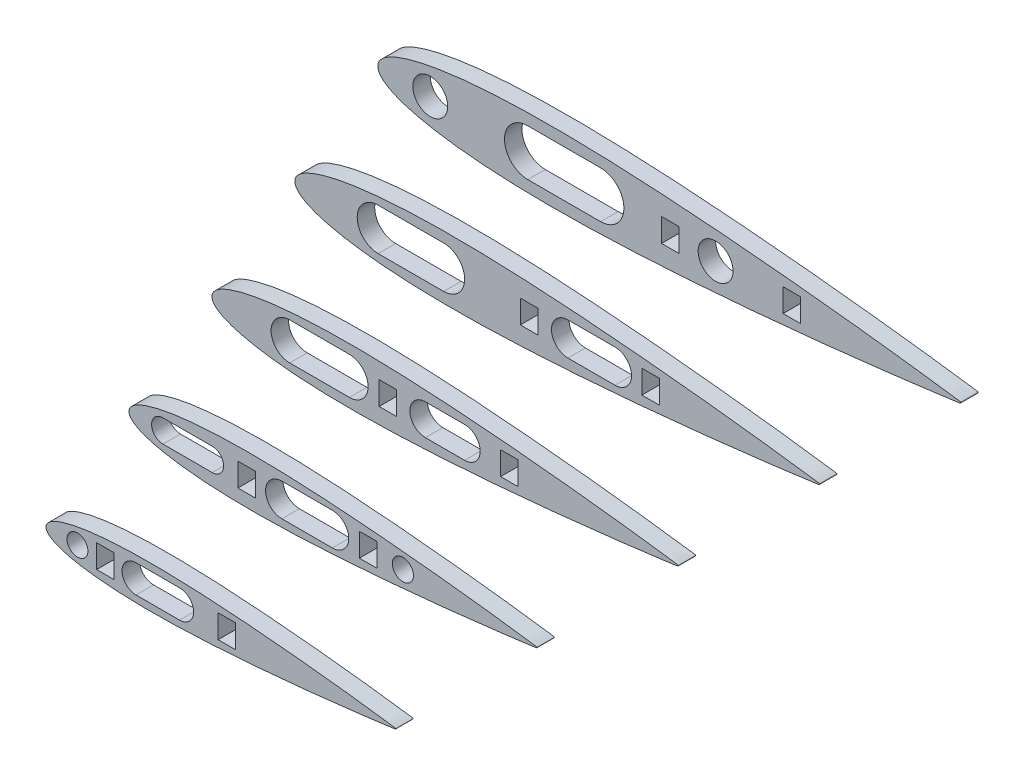
from build123d import *

# Parameters (mm, degrees)
SKETCH1_R               = 3
BOSS_EXTRUDE2_DEPTH     = 3
BOSS_EXTRUDE3_DEPTH     = 3
BOSS_EXTRUDE4_DEPTH     = 3
SKETCH5_R               = 1.818573192
BOSS_EXTRUDE5_DEPTH     = 3
SKETCH6_R               = 1.8
SKETCH6_W               = 4
SKETCH6_H               = 3
BOSS_EXTRUDE6_DEPTH     = 3
CUT_EXTRUDE1_DEPTH      = 124.852655878
CUT_EXTRUDE1_DEPTH_BACK = 124.852655878
SKETCH7_W               = 4
SKETCH7_H               = 3


with BuildPart() as part:
    # Sketch1 → Boss-Extrude2 (new body)
    with BuildSketch(Plane(origin=(0, 0, 0), x_dir=(0, 1, 0), z_dir=(0, 0, 1))):
        with BuildLine():
            add(Edge.make_bspline(
                [(0, 0), (-0.143769426, 0), (-0.438697819, -0.04120027), (-0.866196679, -0.22598864), (-1.277635279, -0.527957176), (-1.674799366, -0.943440229), (-2.059083944, -1.471093478), (-2.430856179, -2.110148633), (-2.78969367, -2.859670429), (-3.134783007, -3.71832995), (-3.465097027, -4.684423717), (-3.779529109, -5.755889731), (-4.076894627, -6.930369882), (-4.356114061, -8.205198169), (-4.616040377, -9.57747356), (-4.85572786, -11.04402374), (-5.074192838, -12.60146397), (-5.270697786, -14.246171736), (-5.444540786, -15.974324697), (-5.595238122, -17.781893153), (-5.72244121, -19.664665268), (-5.82593648, -21.61825492), (-5.905747055, -23.638100728), (-5.962022136, -25.71948685), (-5.995069232, -27.857555929), (-6.005399921, -30.047319669), (-5.993631954, -32.283663665), (-5.96053489, -34.561366223), (-5.907005527, -36.875108981), (-5.834061401, -39.21949426), (-5.74276792, -41.589046368), (-5.634299612, -43.97823051), (-5.509887613, -46.381468766), (-5.370785292, -48.793152217), (-5.218284943, -51.207649327), (-5.053683293, -53.619321359), (-4.878272702, -56.022538791), (-4.69336801, -58.411688116), (-4.500206502, -60.781191069), (-4.300049987, -63.125509835), (-4.09411158, -65.439177904), (-3.883575485, -67.716784958), (-3.669623181, -69.953017215), (-3.453343429, -72.142644472), (-3.235859617, -74.280562974), (-3.018229162, -76.361770373), (-2.801522181, -78.381411181), (-2.586792905, -80.334764283), (-2.37500346, -82.217265919), (-2.167230018, -84.024526899), (-1.964438783, -85.752322746), (-1.767626092, -87.396617921), (-1.577761697, -88.953567454), (-1.395840832, -90.419541542), (-1.222780671, -91.791112451), (-1.05954918, -93.065079393), (-0.906985896, -94.238461728), (-0.766020085, -95.308522773), (-0.637435197, -96.272773219), (-0.521957457, -97.128923159), (-0.420522285, -97.8750951), (-0.33302276, -98.509180347), (-0.262165372, -99.030742547), (-0.202618046, -99.435773194), (-0.168833736, -99.730103445), (-0.132274345, -99.899188809), (-0.135578348, -100.072623775), (0.135578348, -100.072623775), (0.132274345, -99.899188809), (0.168833736, -99.730103445), (0.202618046, -99.435773194), (0.262165372, -99.030742547), (0.33302276, -98.509180347), (0.420522285, -97.8750951), (0.521957457, -97.128923159), (0.637435197, -96.272773219), (0.766020085, -95.308522773), (0.906985896, -94.238461728), (1.05954918, -93.065079393), (1.222780671, -91.791112451), (1.395840832, -90.419541542), (1.577761697, -88.953567454), (1.767626092, -87.396617921), (1.964438783, -85.752322746), (2.167230018, -84.024526899), (2.37500346, -82.217265919), (2.586792905, -80.334764283), (2.801522181, -78.381411181), (3.018229162, -76.361770373), (3.235859617, -74.280562974), (3.453343429, -72.142644472), (3.669623181, -69.953017215), (3.883575485, -67.716784958), (4.09411158, -65.439177904), (4.300049987, -63.125509835), (4.500206502, -60.781191069), (4.69336801, -58.411688116), (4.878272702, -56.022538791), (5.053683293, -53.619321359), (5.218284943, -51.207649327), (5.370785292, -48.793152217), (5.509887613, -46.381468766), (5.634299612, -43.97823051), (5.74276792, -41.589046368), (5.834061401, -39.21949426), (5.907005527, -36.875108981), (5.96053489, -34.561366223), (5.993631954, -32.283663665), (6.005399921, -30.047319669), (5.995069232, -27.857555929), (5.962022136, -25.71948685), (5.905747055, -23.638100728), (5.82593648, -21.61825492), (5.72244121, -19.664665268), (5.595238122, -17.781893153), (5.444540786, -15.974324697), (5.270697786, -14.246171736), (5.074192838, -12.60146397), (4.85572786, -11.04402374), (4.616040377, -9.57747356), (4.356114061, -8.205198169), (4.076894627, -6.930369882), (3.779529109, -5.755889731), (3.465097027, -4.684423717), (3.134783007, -3.71832995), (2.78969367, -2.859670429), (2.430856179, -2.110148633), (2.059083944, -1.471093478), (1.674799366, -0.943440229), (1.277635279, -0.527957176), (0.866196679, -0.22598864), (0.438697819, -0.04120027), (0.143769426, 0), (0, 0)],
                knots=[0, 0, 0, 0, 0.002106168, 0.00432059, 0.006772783, 0.009556697, 0.012734041, 0.016342888, 0.020405604, 0.024934102, 0.029933071, 0.035402241, 0.04133743, 0.04773159, 0.054575389, 0.061857405, 0.069564571, 0.077682311, 0.086194684, 0.095084441, 0.104333244, 0.1139217, 0.123829339, 0.134034708, 0.144515531, 0.155248716, 0.166210356, 0.177375783, 0.188719821, 0.200216647, 0.211839951, 0.223562989, 0.235358653, 0.247199625, 0.259058395, 0.270907226, 0.282718457, 0.294464514, 0.306117689, 0.317650771, 0.329036618, 0.34024851, 0.351259999, 0.362045273, 0.372578891, 0.382836142, 0.392792739, 0.40242532, 0.411711115, 0.420628244, 0.429155673, 0.437273179, 0.444961561, 0.452202575, 0.458979063, 0.465274876, 0.471074963, 0.476365569, 0.481133961, 0.485368768, 0.489059784, 0.492198148, 0.494776266, 0.49678801, 0.498228425, 0.499094073, 0.499382862, 0.500617138, 0.500905927, 0.501771575, 0.50321199, 0.505223734, 0.507801852, 0.510940216, 0.514631232, 0.518866039, 0.523634431, 0.528925037, 0.534725124, 0.541020937, 0.547797425, 0.555038439, 0.562726821, 0.570844327, 0.579371756, 0.588288885, 0.59757468, 0.607207261, 0.617163858, 0.627421109, 0.637954727, 0.648740001, 0.65975149, 0.670963382, 0.682349229, 0.693882311, 0.705535486, 0.717281543, 0.729092774, 0.740941605, 0.752800375, 0.764641347, 0.776437011, 0.788160049, 0.799783353, 0.811280179, 0.822624217, 0.833789644, 0.844751284, 0.855484469, 0.865965292, 0.876170661, 0.8860783, 0.895666756, 0.904915559, 0.913805316, 0.922317689, 0.930435429, 0.938142595, 0.945424611, 0.95226841, 0.95866257, 0.964597759, 0.970066929, 0.975065898, 0.979594396, 0.983657112, 0.987265959, 0.990443303, 0.993227217, 0.99567941, 0.997893832, 1, 1, 1, 1], degree=3))
        make_face()
        with Locations(Location((0, -9, 0), (0, 0, 270))):
            Circle(SKETCH1_R, mode=Mode.SUBTRACT)
        with Locations(Location((0, -58, 0), (0, 0, 270))):
            Circle(SKETCH1_R, mode=Mode.SUBTRACT)
        with BuildLine():
            Line((-4, -38.25), (-4, -25.75))
            ThreePointArc((-4, -25.75), (0, -21.75), (4, -25.75))
            Line((4, -25.75), (4, -38.25))
            ThreePointArc((4, -38.25), (0, -42.25), (-4, -38.25))
        make_face(mode=Mode.SUBTRACT)
    extrude(amount=BOSS_EXTRUDE2_DEPTH)


with BuildPart() as body_2:
    # Sketch3 → Boss-Extrude3 (new body)
    with BuildSketch(Plane(origin=(0, 0, 24.25), x_dir=(0, 1, 0), z_dir=(0, 0, 1))):
        with BuildLine():
            add(Edge.make_bspline(
                [(0, -10.005446783), (-0.129392484, -10.005446783), (-0.394828037, -10.042527026), (-0.779577011, -10.208836559), (-1.149871751, -10.480608241), (-1.507319429, -10.854542989), (-1.853175549, -11.329430913), (-2.187770561, -11.904580553), (-2.510724303, -12.579150169), (-2.821304707, -13.351943738), (-3.118587324, -14.221428129), (-3.401576198, -15.185747541), (-3.669205165, -16.242779677), (-3.920502655, -17.390125136), (-4.154436339, -18.625172987), (-4.370155074, -19.945068149), (-4.566773554, -21.346764356), (-4.743628007, -22.827001345), (-4.900086707, -24.38233901), (-5.03571431, -26.009150621), (-5.150197089, -27.703645525), (-5.243342832, -29.461876211), (-5.31517235, -31.279737438), (-5.365819923, -33.152984948), (-5.395562308, -35.077247119), (-5.404859929, -37.048034485), (-5.394268759, -39.060744082), (-5.364481401, -41.110676384), (-5.316304974, -43.193044866), (-5.250655261, -45.302991617), (-5.168491128, -47.435588514), (-5.070869651, -49.585854242), (-4.958898851, -51.748768673), (-4.833706763, -53.919283779), (-4.696456449, -56.092331177), (-4.548314963, -58.262836006), (-4.390445432, -60.425731695), (-4.224031209, -62.575966088), (-4.050185852, -64.708518745), (-3.870044989, -66.818405635), (-3.684700422, -68.900706897), (-3.495217936, -70.950553245), (-3.302660863, -72.963162277), (-3.108009086, -74.933826808), (-2.912273656, -76.85795346), (-2.716406246, -78.731040118), (-2.521369963, -80.548716846), (-2.328113615, -82.306734638), (-2.137503114, -84.000986111), (-1.950507016, -85.627520992), (-1.767994904, -87.182537254), (-1.590863483, -88.662402912), (-1.419985527, -90.063657492), (-1.256256749, -91.383034171), (-1.100502604, -92.617447989), (-0.953594262, -93.764018237), (-0.816287307, -94.820062339), (-0.689418076, -95.783117279), (-0.573691677, -96.65094268), (-0.469761711, -97.421477627), (-0.378470056, -98.093032373), (-0.299720484, -98.663709095), (-0.235948835, -99.133115076), (-0.182356241, -99.497642658), (-0.151950363, -99.762539884), (-0.119046911, -99.914716711), (-0.122020513, -100.070808181), (0.122020513, -100.070808181), (0.119046911, -99.914716711), (0.151950363, -99.762539884), (0.182356241, -99.497642658), (0.235948835, -99.133115076), (0.299720484, -98.663709095), (0.378470056, -98.093032373), (0.469761711, -97.421477627), (0.573691677, -96.65094268), (0.689418076, -95.783117279), (0.816287307, -94.820062339), (0.953594262, -93.764018237), (1.100502604, -92.617447989), (1.256256749, -91.383034171), (1.419985527, -90.063657492), (1.590863483, -88.662402912), (1.767994904, -87.182537254), (1.950507016, -85.627520992), (2.137503114, -84.000986111), (2.328113615, -82.306734638), (2.521369963, -80.548716846), (2.716406246, -78.731040118), (2.912273656, -76.85795346), (3.108009086, -74.933826808), (3.302660863, -72.963162277), (3.495217936, -70.950553245), (3.684700422, -68.900706897), (3.870044989, -66.818405635), (4.050185852, -64.708518745), (4.224031209, -62.575966088), (4.390445432, -60.425731695), (4.548314963, -58.262836006), (4.696456449, -56.092331177), (4.833706763, -53.919283779), (4.958898851, -51.748768673), (5.070869651, -49.585854242), (5.168491128, -47.435588514), (5.250655261, -45.302991617), (5.316304974, -43.193044866), (5.364481401, -41.110676384), (5.394268759, -39.060744082), (5.404859929, -37.048034485), (5.395562308, -35.077247119), (5.365819923, -33.152984948), (5.31517235, -31.279737438), (5.243342832, -29.461876211), (5.150197089, -27.703645525), (5.03571431, -26.009150621), (4.900086707, -24.38233901), (4.743628007, -22.827001345), (4.566773554, -21.346764356), (4.370155074, -19.945068149), (4.154436339, -18.625172987), (3.920502655, -17.390125136), (3.669205165, -16.242779677), (3.401576198, -15.185747541), (3.118587324, -14.221428129), (2.821304707, -13.351943738), (2.510724303, -12.579150169), (2.187770561, -11.904580553), (1.853175549, -11.329430913), (1.507319429, -10.854542989), (1.149871751, -10.480608241), (0.779577011, -10.208836559), (0.394828037, -10.042527026), (0.129392484, -10.005446783), (0, -10.005446783)],
                knots=[0, 0, 0, 0, 0.002106168, 0.00432059, 0.006772783, 0.009556697, 0.012734041, 0.016342888, 0.020405604, 0.024934102, 0.029933071, 0.035402241, 0.04133743, 0.04773159, 0.054575389, 0.061857405, 0.069564571, 0.077682311, 0.086194684, 0.095084441, 0.104333244, 0.1139217, 0.123829339, 0.134034708, 0.144515531, 0.155248716, 0.166210356, 0.177375783, 0.188719821, 0.200216647, 0.211839951, 0.223562989, 0.235358653, 0.247199625, 0.259058395, 0.270907226, 0.282718457, 0.294464514, 0.306117689, 0.317650771, 0.329036618, 0.34024851, 0.351259999, 0.362045273, 0.372578891, 0.382836142, 0.392792739, 0.40242532, 0.411711115, 0.420628244, 0.429155673, 0.437273179, 0.444961561, 0.452202575, 0.458979063, 0.465274876, 0.471074963, 0.476365569, 0.481133961, 0.485368768, 0.489059784, 0.492198148, 0.494776266, 0.49678801, 0.498228425, 0.499094073, 0.499382862, 0.500617138, 0.500905927, 0.501771575, 0.50321199, 0.505223734, 0.507801852, 0.510940216, 0.514631232, 0.518866039, 0.523634431, 0.528925037, 0.534725124, 0.541020937, 0.547797425, 0.555038439, 0.562726821, 0.570844327, 0.579371756, 0.588288885, 0.59757468, 0.607207261, 0.617163858, 0.627421109, 0.637954727, 0.648740001, 0.65975149, 0.670963382, 0.682349229, 0.693882311, 0.705535486, 0.717281543, 0.729092774, 0.740941605, 0.752800375, 0.764641347, 0.776437011, 0.788160049, 0.799783353, 0.811280179, 0.822624217, 0.833789644, 0.844751284, 0.855484469, 0.865965292, 0.876170661, 0.8860783, 0.895666756, 0.904915559, 0.913805316, 0.922317689, 0.930435429, 0.938142595, 0.945424611, 0.95226841, 0.95866257, 0.964597759, 0.970066929, 0.975065898, 0.979594396, 0.983657112, 0.987265959, 0.990443303, 0.993227217, 0.99567941, 0.997893832, 1, 1, 1, 1], degree=3))
        make_face()
        with BuildLine():
            Line((2.840224155, -56.905789936), (2.840224155, -64.978099484))
            ThreePointArc((2.840224155, -64.978099484), (0, -67.818323639), (-2.840224155, -64.978099484))
            Line((-2.840224155, -64.978099484), (-2.840224155, -56.905789936))
            ThreePointArc((-2.840224155, -56.905789936), (0, -54.065565781), (2.840224155, -56.905789936))
        make_face(mode=Mode.SUBTRACT)
        with BuildLine():
            Line((3.6, -35.558508419), (3.6, -24.308508419))
            ThreePointArc((3.6, -24.308508419), (0, -20.708508419), (-3.6, -24.308508419))
            Line((-3.6, -24.308508419), (-3.6, -35.558508419))
            ThreePointArc((-3.6, -35.558508419), (0, -39.158508419), (3.6, -35.558508419))
        make_face(mode=Mode.SUBTRACT)
    extrude(amount=BOSS_EXTRUDE3_DEPTH)


with BuildPart() as body_3:
    # Sketch4 → Boss-Extrude4 (new body)
    with BuildSketch(Plane(origin=(0, 0, 48.5), x_dir=(0, 1, 0), z_dir=(0, 0, 1))):
        with BuildLine():
            add(Edge.make_bspline(
                [(0, -20.010893566), (-0.115015542, -20.010893413), (-0.350958301, -20.043853314), (-0.692957589, -20.191683555), (-1.022108794, -20.433257946), (-1.339840509, -20.765643967), (-1.647268736, -21.187766159), (-1.944687209, -21.699009889), (-2.231758003, -22.298626947), (-2.507830392, -22.9855542), (-2.77208264, -23.758428866), (-3.023629451, -24.615601347), (-3.261523121, -25.555185157), (-3.48490003, -26.575047496), (-3.692842549, -27.672867538), (-3.884594102, -28.846107434), (-4.059367748, -30.092059394), (-4.216573463, -31.407825405), (-4.355649708, -32.790347598), (-4.476209508, -34.236402212), (-4.577973988, -35.742619778), (-4.66077229, -37.305491399), (-4.724622907, -38.921367971), (-4.769645194, -40.58647682), (-4.796085152, -42.296932059), (-4.804352042, -44.048743052), (-4.794940055, -45.837818273), (-4.768464835, -47.659980367), (-4.725643814, -49.510974643), (-4.667291014, -51.386482956), (-4.594258759, -53.282124753), (-4.507486662, -55.193472195), (-4.407959627, -57.116062945), (-4.296680344, -59.045409868), (-4.174682641, -60.977007731), (-4.043003894, -62.906345546), (-3.902677986, -64.828919691), (-3.754756781, -66.740239361), (-3.600230103, -68.635841942), (-3.440107393, -70.511297182), (-3.275359135, -72.362231869), (-3.106932689, -74.184317749), (-2.935773232, -75.973303795), (-2.762751766, -77.725005842), (-2.588766998, -79.435340888), (-2.414664854, -81.10030705), (-2.241301424, -82.716019939), (-2.069520087, -84.278702661), (-1.900090539, -85.784704206), (-1.733873713, -87.23051322), (-1.571642568, -88.612750124), (-1.41419417, -89.928186483), (-1.262304315, -91.17374632), (-1.116769187, -92.346525793), (-0.978322521, -93.443782712), (-0.847738687, -94.462956447), (-0.725689312, -95.401662484), (-0.612917804, -96.257711476), (-0.510050922, -97.029111975), (-0.417669643, -97.714032055), (-0.336522302, -98.31096972), (-0.266523358, -98.818238014), (-0.209838004, -99.235487853), (-0.162200575, -99.559512436), (-0.135173441, -99.794976675), (-0.105926109, -99.930245006), (-0.108569496, -100.068992976), (0.108355862, -100.068993265), (0.105712845, -99.930245288), (0.134960539, -99.794977035), (0.161988301, -99.559512868), (0.209626594, -99.235488413), (0.266313061, -98.818238725), (0.336313359, -98.310970618), (0.417462294, -97.714033169), (0.5098454, -97.029113336), (0.61271434, -96.257713111), (0.725488132, -95.40166442), (0.847540013, -94.462958708), (0.978126566, -93.443785322), (1.11657616, -92.346528773), (1.262114417, -91.173749688), (1.414007597, -89.928190257), (1.571459505, -88.612754318), (1.733694338, -87.230517847), (1.899915023, -85.784709276), (2.069348589, -84.278708183), (2.241134096, -82.71602592), (2.414501837, -81.100313494), (2.588608424, -79.435347796), (2.762597757, -77.725013215), (2.935623897, -75.973311629), (3.106788128, -74.184326039), (3.275219436, -72.362240609), (3.439972633, -70.511306361), (3.600100348, -68.635851549), (3.754632084, -66.740249381), (3.90255839, -64.828930105), (4.042889428, -62.906356334), (4.174573323, -60.977018871), (4.296576181, -59.045421333), (4.407860612, -57.116074708), (4.507392777, -55.193484223), (4.594169975, -53.282137012), (4.667207289, -51.386495411), (4.725565093, -49.510987253), (4.768391053, -47.659993092), (4.794871136, -45.837831068), (4.804287897, -44.048755872), (4.796025682, -42.296944857), (4.769590288, -40.586489548), (4.724572445, -38.921380579), (4.66072614, -37.305503836), (4.577932008, -35.742631994), (4.476171547, -34.236414156), (4.355615607, -32.790359221), (4.21654305, -31.407836657), (4.059340847, -30.092070226), (3.884570526, -28.8461178), (3.692822103, -27.672877393), (3.484882514, -26.575056795), (3.261508326, -25.55519386), (3.023617164, -24.615609416), (2.77207264, -23.758436264), (2.507822454, -22.985560892), (2.231751898, -22.298632902), (1.944682704, -21.699015078), (1.647265596, -21.187770554), (1.339838495, -20.765647542), (1.022107666, -20.433260673), (0.692957107, -20.191685404), (0.350958213, -20.04385425), (0.115015542, -20.01089372), (0, -20.010893566)],
                knots=[0, 0, 0, 0, 0.002106168, 0.00432059, 0.006772783, 0.009556697, 0.012734041, 0.016342888, 0.020405604, 0.024934102, 0.029933071, 0.035402241, 0.04133743, 0.04773159, 0.054575389, 0.061857405, 0.069564571, 0.077682311, 0.086194684, 0.095084441, 0.104333244, 0.1139217, 0.123829339, 0.134034708, 0.144515531, 0.155248716, 0.166210356, 0.177375783, 0.188719821, 0.200216647, 0.211839951, 0.223562989, 0.235358653, 0.247199625, 0.259058395, 0.270907226, 0.282718457, 0.294464514, 0.306117689, 0.317650771, 0.329036618, 0.34024851, 0.351259999, 0.362045273, 0.372578891, 0.382836142, 0.392792739, 0.40242532, 0.411711115, 0.420628244, 0.429155673, 0.437273179, 0.444961561, 0.452202575, 0.458979063, 0.465274876, 0.471074963, 0.476365569, 0.481133961, 0.485368768, 0.489059784, 0.492198148, 0.494776266, 0.49678801, 0.498228425, 0.499094073, 0.499382862, 0.500617138, 0.500905927, 0.501771575, 0.50321199, 0.505223734, 0.507801852, 0.510940216, 0.514631232, 0.518866039, 0.523634431, 0.528925037, 0.534725124, 0.541020937, 0.547797425, 0.555038439, 0.562726821, 0.570844327, 0.579371756, 0.588288885, 0.59757468, 0.607207261, 0.617163858, 0.627421109, 0.637954727, 0.648740001, 0.65975149, 0.670963382, 0.682349229, 0.693882311, 0.705535486, 0.717281543, 0.729092774, 0.740941605, 0.752800375, 0.764641347, 0.776437011, 0.788160049, 0.799783353, 0.811280179, 0.822624217, 0.833789644, 0.844751284, 0.855484469, 0.865965292, 0.876170661, 0.8860783, 0.895666756, 0.904915559, 0.913805316, 0.922317689, 0.930435429, 0.938142595, 0.945424611, 0.95226841, 0.95866257, 0.964597759, 0.970066929, 0.975065898, 0.979594396, 0.983657112, 0.987265959, 0.990443303, 0.993227217, 0.99567941, 0.997893832, 1, 1, 1, 1], degree=3))
        make_face()
        with BuildLine():
            Line((-2.664221839, -63.403189225), (-2.664272217, -56.662211272))
            ThreePointArc((-2.664272217, -56.662211272), (0.000253998, -53.99764523), (2.66482004, -56.662171446))
            Line((2.66482004, -56.662171446), (2.664870419, -63.403149399))
            ThreePointArc((2.664870419, -63.403149399), (0.000344203, -66.067715441), (-2.664221839, -63.403189225))
        make_face(mode=Mode.SUBTRACT)
        with BuildLine():
            Line((3.200099858, -43.628812545), (3.200099858, -33.372612968))
            ThreePointArc((3.200099858, -33.372612968), (9.9858e-05, -30.172612968), (-3.199900142, -33.372612968))
            Line((-3.199900142, -33.372612968), (-3.199900142, -43.628812545))
            ThreePointArc((-3.199900142, -43.628812545), (9.9858e-05, -46.828812545), (3.200099858, -43.628812545))
        make_face(mode=Mode.SUBTRACT)
    extrude(amount=BOSS_EXTRUDE4_DEPTH)


with BuildPart() as body_4:
    # Sketch5 → Boss-Extrude5 (new body)
    with BuildSketch(Plane(origin=(0, 0, 72.75), x_dir=(0, 1, 0), z_dir=(0, 0, 1))):
        with BuildLine():
            add(Edge.make_bspline(
                [(0.04947784, -30.016338894), (-0.05116075, -30.016209366), (-0.257647727, -30.044783841), (-0.557063389, -30.17375054), (-0.84534244, -30.384757818), (-1.123731603, -30.675238112), (-1.393206169, -31.044249141), (-1.654022462, -31.49125277), (-1.905883958, -32.015594695), (-2.148220073, -32.616345408), (-2.380310259, -33.292313399), (-2.601378023, -34.042056265), (-2.810592002, -34.863924398), (-3.00719413, -35.756052569), (-3.190378871, -36.716411089), (-3.359481366, -37.74278019), (-3.513809995, -38.832791441), (-3.652845226, -39.983909747), (-3.776092274, -41.193460102), (-3.883208907, -42.458622152), (-3.973947322, -43.776447926), (-4.048154067, -45.14386733), (-4.10584122, -46.557687379), (-4.147108972, -48.014606848), (-4.172168204, -49.511225311), (-4.181372526, -51.0440505), (-4.175149756, -52.609501775), (-4.154033881, -54.203923257), (-4.118647867, -55.823591286), (-4.069699127, -57.464726568), (-4.007928514, -59.123495162), (-3.93415321, -60.796021651), (-3.849229985, -62.478400385), (-3.754031144, -64.166703989), (-3.649456219, -65.856989224), (-3.536407838, -67.545307808), (-3.415785584, -69.227717911), (-3.288504783, -70.900288893), (-3.155426513, -72.559114854), (-3.017429048, -74.200318189), (-2.875356645, -75.820071246), (-2.730033371, -77.414585737), (-2.582281476, -78.98014095), (-2.432858379, -80.513074762), (-2.282545854, -82.009813534), (-2.132079584, -83.466854669), (-1.98220428, -84.880798362), (-1.833653648, -86.248338883), (-1.687097064, -87.566280732), (-1.543283895, -88.831550508), (-1.402886678, -90.041190207), (-1.266599213, -91.192374054), (-1.135096861, -92.282409696), (-1.009073017, -93.308755376), (-0.889166613, -94.269010852), (-0.776052343, -95.160934702), (-0.670315197, -95.982439721), (-0.572603195, -96.731609394), (-0.48346251, -97.4067005), (-0.403399436, -98.006109449), (-0.333067075, -98.528521152), (-0.272388684, -98.972459621), (-0.223258411, -99.337616971), (-0.181940194, -99.621192049), (-0.158556352, -99.827253646), (-0.133117115, -99.945646329), (-0.135586171, -100.067047819), (0.054223501, -100.067292114), (0.052066953, -99.945884671), (0.07781086, -99.827557864), (0.101725048, -99.621557142), (0.14377308, -99.33808936), (0.193843143, -98.973059687), (0.255664077, -98.529278881), (0.327340946, -98.007049951), (0.408946695, -97.407849078), (0.499824839, -96.732989667), (0.599464957, -95.984073996), (0.707316391, -95.162843877), (0.82272619, -94.27121415), (0.945103993, -93.311270506), (1.073769339, -92.285252625), (1.20807712, -91.195559095), (1.347327399, -90.04472988), (1.490837888, -88.835455585), (1.637907516, -87.570560191), (1.787856132, -86.25299996), (1.939926462, -84.885846355), (2.093440906, -83.47229314), (2.247657251, -82.015644149), (2.401822038, -80.519297255), (2.555190569, -78.986753152), (2.706971875, -77.421583454), (2.856399112, -75.827448323), (3.002640456, -74.208066341), (3.14486209, -72.567223664), (3.282209908, -70.908745755), (3.413795657, -69.236507948), (3.538748209, -67.554413914), (3.65614212, -65.866391921), (3.765067667, -64.176381472), (3.86461206, -62.488328513), (3.95386562, -60.806173954), (4.031945935, -59.133842911), (4.097986185, -57.475238817), (4.151159214, -55.834234971), (4.190714302, -54.214663396), (4.215934313, -52.62030155), (4.226186695, -51.05487148), (4.220928053, -49.522027676), (4.199721355, -48.025349667), (4.162204, -46.568328797), (4.108156356, -45.154364939), (4.037469735, -43.786759049), (3.950123841, -42.468704071), (3.84626422, -41.203270483), (3.726131087, -39.993406885), (3.590059414, -38.841934502), (3.438537097, -37.751529604), (3.272077142, -36.724728617), (3.09136507, -35.763901742), (2.897060023, -34.871270452), (2.68996231, -34.048866504), (2.470825194, -33.298557071), (2.240475788, -32.621993895), (1.99968687, -32.020621374), (1.749175919, -31.495632869), (1.489511123, -31.047959352), (1.220987323, -30.678255891), (0.943346808, -30.387059957), (0.655611866, -30.175311318), (0.35652917, -30.045574319), (0.150116431, -30.016468421), (0.04947784, -30.016338894)],
                knots=[0, 0, 0, 0, 0.002106168, 0.00432059, 0.006772783, 0.009556697, 0.012734041, 0.016342888, 0.020405604, 0.024934102, 0.029933071, 0.035402241, 0.04133743, 0.04773159, 0.054575389, 0.061857405, 0.069564571, 0.077682311, 0.086194684, 0.095084441, 0.104333244, 0.1139217, 0.123829339, 0.134034708, 0.144515531, 0.155248716, 0.166210356, 0.177375783, 0.188719821, 0.200216647, 0.211839951, 0.223562989, 0.235358653, 0.247199625, 0.259058395, 0.270907226, 0.282718457, 0.294464514, 0.306117689, 0.317650771, 0.329036618, 0.34024851, 0.351259999, 0.362045273, 0.372578891, 0.382836142, 0.392792739, 0.40242532, 0.411711115, 0.420628244, 0.429155673, 0.437273179, 0.444961561, 0.452202575, 0.458979063, 0.465274876, 0.471074963, 0.476365569, 0.481133961, 0.485368768, 0.489059784, 0.492198148, 0.494776266, 0.49678801, 0.498228425, 0.499094073, 0.499382862, 0.500617138, 0.500905927, 0.501771575, 0.50321199, 0.505223734, 0.507801852, 0.510940216, 0.514631232, 0.518866039, 0.523634431, 0.528925037, 0.534725124, 0.541020937, 0.547797425, 0.555038439, 0.562726821, 0.570844327, 0.579371756, 0.588288885, 0.59757468, 0.607207261, 0.617163858, 0.627421109, 0.637954727, 0.648740001, 0.65975149, 0.670963382, 0.682349229, 0.693882311, 0.705535486, 0.717281543, 0.729092774, 0.740941605, 0.752800375, 0.764641347, 0.776437011, 0.788160049, 0.799783353, 0.811280179, 0.822624217, 0.833789644, 0.844751284, 0.855484469, 0.865965292, 0.876170661, 0.8860783, 0.895666756, 0.904915559, 0.913805316, 0.922317689, 0.930435429, 0.938142595, 0.945424611, 0.95226841, 0.95866257, 0.964597759, 0.970066929, 0.975065898, 0.979594396, 0.983657112, 0.987265959, 0.990443303, 0.993227217, 0.99567941, 0.997893832, 1, 1, 1, 1], degree=3))
        make_face()
        with Locations(Location((0.04947784, -77.056013283, 0), (0, 0, 270))):
            Circle(SKETCH5_R, mode=Mode.SUBTRACT)
        with BuildLine():
            Line((-1.901087828, -44.328048798), (-1.901087828, -35.850665046))
            ThreePointArc((-1.901087828, -35.850665046), (0.04947784, -33.900099377), (2.000043509, -35.850665046))
            Line((2.000043509, -35.850665046), (2.000043509, -44.328048798))
            ThreePointArc((2.000043509, -44.328048798), (0.04947784, -46.278614466), (-1.901087828, -44.328048798))
        make_face(mode=Mode.SUBTRACT)
        with BuildLine():
            Line((2.800757244, -64.954513693), (2.800757244, -56.274059996))
            ThreePointArc((2.800757244, -56.274059996), (0.000757244, -53.474059996), (-2.799242756, -56.274059996))
            Line((-2.799242756, -56.274059996), (-2.799242756, -64.954513693))
            ThreePointArc((-2.799242756, -64.954513693), (0.000757244, -67.754513693), (2.800757244, -64.954513693))
        make_face(mode=Mode.SUBTRACT)
    extrude(amount=BOSS_EXTRUDE5_DEPTH)


with BuildPart() as body_5:
    # Sketch6 → Boss-Extrude6 (new body)
    with BuildSketch(Plane(origin=(0, 0, 97), x_dir=(0, 1, 0), z_dir=(0, 0, 1))):
        with BuildLine():
            add(Edge.make_bspline(
                [(0, -40.021784013), (-0.086261665, -40.021784013), (-0.263218718, -40.046504177), (-0.51971806, -40.157377211), (-0.766581245, -40.33855835), (-1.004879722, -40.587848207), (-1.235450492, -40.904440188), (-1.458513857, -41.28787332), (-1.673816373, -41.737586443), (-1.880869997, -42.252782207), (-2.07905843, -42.832438526), (-2.267717699, -43.475318199), (-2.446137028, -44.180006361), (-2.613668706, -44.944903411), (-2.769624512, -45.768268728), (-2.913437018, -46.648198925), (-3.044516019, -47.582663158), (-3.162419, -48.569487917), (-3.266724812, -49.606379799), (-3.357143224, -50.690920982), (-3.433465085, -51.820584365), (-3.495562255, -52.992738275), (-3.543448606, -54.204645883), (-3.57721366, -55.453477682), (-3.59704192, -56.736319259), (-3.603240336, -58.050177637), (-3.596179556, -59.39198417), (-3.576321317, -60.758605843), (-3.544203698, -62.146851639), (-3.500437219, -63.553482948), (-3.445661126, -64.975214357), (-3.380580136, -66.408724987), (-3.305932931, -67.850668087), (-3.222471531, -69.297678305), (-3.130971314, -70.746376717), (-3.032210315, -72.193380083), (-2.926963952, -73.635310689), (-2.816021126, -75.068800429), (-2.700124212, -76.490502344), (-2.580030292, -77.897093747), (-2.456467236, -79.285294729), (-2.330145568, -80.6518591), (-2.201774174, -81.99359859), (-2.072006311, -83.307375077), (-1.941516012, -84.590126309), (-1.810937727, -85.838850874), (-1.680913526, -87.050635482), (-1.552075949, -88.222647462), (-1.42500227, -89.352148558), (-1.300338193, -90.436505256), (-1.178663441, -91.473182869), (-1.060575816, -92.459760075), (-0.946657168, -93.393929889), (-0.837504639, -94.273514431), (-0.733668533, -95.096457059), (-0.635729629, -95.860837302), (-0.54419165, -96.564866775), (-0.459612155, -97.206903467), (-0.382461215, -97.785453793), (-0.313174565, -98.299143809), (-0.252313456, -98.746847019), (-0.199813736, -99.127298206), (-0.157299299, -99.440235558), (-0.1215709, -99.68325397), (-0.101300313, -99.859852139), (-0.079364676, -99.961303368), (-0.081347078, -100.065364358), (0.081346956, -100.065364358), (0.079364554, -99.961303368), (0.101300192, -99.859852139), (0.12157078, -99.683253971), (0.157299179, -99.440235558), (0.199813616, -99.127298206), (0.252313337, -98.74684702), (0.313174447, -98.29914381), (0.382461099, -97.785453794), (0.45961204, -97.206903468), (0.544191536, -96.564866776), (0.635729516, -95.860837304), (0.733668421, -95.096457061), (0.837504529, -94.273514433), (0.94665706, -93.393929891), (1.06057571, -92.459760077), (1.178663337, -91.473182872), (1.300338091, -90.436505259), (1.425002171, -89.352148561), (1.552075852, -88.222647465), (1.680913431, -87.050635486), (1.810937634, -85.838850878), (1.941515922, -84.590126312), (2.072006223, -83.307375081), (2.201774089, -81.993598595), (2.330145486, -80.651859104), (2.456467157, -79.285294734), (2.580030215, -77.897093752), (2.700124138, -76.49050235), (2.816021055, -75.068800435), (2.926963884, -73.635310695), (3.03221025, -72.193380089), (3.130971252, -70.746376723), (3.222471472, -69.297678311), (3.305932874, -67.850668094), (3.380580083, -66.408724994), (3.445661076, -64.975214364), (3.500437171, -63.553482955), (3.544203653, -62.146851646), (3.576321275, -60.758605851), (3.596179517, -59.391984177), (3.6032403, -58.050177644), (3.597041886, -56.736319267), (3.577213628, -55.45347769), (3.543448578, -54.20464589), (3.495562229, -52.992738282), (3.433465062, -51.820584372), (3.357143202, -50.690920989), (3.266724792, -49.606379805), (3.162418983, -48.569487923), (3.044516004, -47.582663164), (2.913437004, -46.648198931), (2.769624501, -45.768268734), (2.613668696, -44.944903416), (2.44613702, -44.180006366), (2.267717692, -43.475318204), (2.079058424, -42.83243853), (1.880869993, -42.252782211), (1.67381637, -41.737586446), (1.458513854, -41.287873323), (1.23545049, -40.904440191), (1.004879721, -40.587848209), (0.766581245, -40.338558351), (0.51971806, -40.157377212), (0.263218718, -40.046504178), (0.086261665, -40.021784013), (0, -40.021784013)],
                knots=[0, 0, 0, 0, 0.002106168, 0.00432059, 0.006772783, 0.009556697, 0.012734041, 0.016342888, 0.020405604, 0.024934102, 0.029933071, 0.035402241, 0.04133743, 0.04773159, 0.054575389, 0.061857405, 0.069564571, 0.077682311, 0.086194684, 0.095084441, 0.104333244, 0.1139217, 0.123829339, 0.134034708, 0.144515531, 0.155248716, 0.166210356, 0.177375783, 0.188719821, 0.200216647, 0.211839951, 0.223562989, 0.235358653, 0.247199625, 0.259058395, 0.270907226, 0.282718457, 0.294464514, 0.306117689, 0.317650771, 0.329036618, 0.34024851, 0.351259999, 0.362045273, 0.372578891, 0.382836142, 0.392792739, 0.40242532, 0.411711115, 0.420628244, 0.429155673, 0.437273179, 0.444961561, 0.452202575, 0.458979063, 0.465274876, 0.471074963, 0.476365569, 0.481133961, 0.485368768, 0.489059784, 0.492198148, 0.494776266, 0.49678801, 0.498228425, 0.499094073, 0.499382862, 0.500617138, 0.500905927, 0.501771575, 0.50321199, 0.505223734, 0.507801852, 0.510940216, 0.514631232, 0.518866039, 0.523634431, 0.528925037, 0.534725124, 0.541020937, 0.547797425, 0.555038439, 0.562726821, 0.570844327, 0.579371756, 0.588288885, 0.59757468, 0.607207261, 0.617163858, 0.627421109, 0.637954727, 0.648740001, 0.65975149, 0.670963382, 0.682349229, 0.693882311, 0.705535486, 0.717281543, 0.729092774, 0.740941605, 0.752800375, 0.764641347, 0.776437011, 0.788160049, 0.799783353, 0.811280179, 0.822624217, 0.833789644, 0.844751284, 0.855484469, 0.865965292, 0.876170661, 0.8860783, 0.895666756, 0.904915559, 0.913805316, 0.922317689, 0.930435429, 0.938142595, 0.945424611, 0.95226841, 0.95866257, 0.964597759, 0.970066929, 0.975065898, 0.979594396, 0.983657112, 0.987265959, 0.990443303, 0.993227217, 0.99567941, 0.997893832, 1, 1, 1, 1], degree=3))
        make_face()
        with Locations(Location((0, -45.421784013, 0), (0, 0, 270))):
            Circle(SKETCH6_R, mode=Mode.SUBTRACT)
        with Locations((-0.001028207, -71.08438213)):
            Rectangle(SKETCH6_W, SKETCH6_H, mode=Mode.SUBTRACT)
        with Locations((-0.000719933, -50.221789913)):
            Rectangle(SKETCH6_W, SKETCH6_H, mode=Mode.SUBTRACT)
        with BuildLine():
            Line((2.4, -62.971784013), (2.4, -55.471784013))
            ThreePointArc((2.4, -55.471784013), (0, -53.071784013), (-2.4, -55.471784013))
            Line((-2.4, -55.471784013), (-2.4, -62.971784013))
            ThreePointArc((-2.4, -62.971784013), (0, -65.371784013), (2.4, -62.971784013))
        make_face(mode=Mode.SUBTRACT)
    extrude(amount=BOSS_EXTRUDE6_DEPTH)


with BuildPart() as cut_extrude1_tool:
    # Sketch7 → Cut-Extrude1 (new, two sides: drawn at the far end of the back side and taken through both)
    with BuildSketch(Plane(origin=(0, 0, 72.75), x_dir=(0, 1, 0), z_dir=(0, 0, 1)).offset(-CUT_EXTRUDE1_DEPTH_BACK)):
        with Locations((-0.000719933, -50.221789913)):
            Rectangle(SKETCH7_W, SKETCH7_H)
        with Locations((-0.001028207, -71.08438213)):
            Rectangle(SKETCH7_W, SKETCH7_H)
    extrude(amount=CUT_EXTRUDE1_DEPTH + CUT_EXTRUDE1_DEPTH_BACK)


with BuildPart() as part_1:
    add(part.part)

    # Cut-Extrude1: cut by cut_extrude1_tool
    add(cut_extrude1_tool.part, mode=Mode.SUBTRACT)


with BuildPart() as body_2_1:
    add(body_2.part)

    # Cut-Extrude1: cut by cut_extrude1_tool
    add(cut_extrude1_tool.part, mode=Mode.SUBTRACT)


with BuildPart() as body_3_1:
    add(body_3.part)

    # Cut-Extrude1: cut by cut_extrude1_tool
    add(cut_extrude1_tool.part, mode=Mode.SUBTRACT)


with BuildPart() as body_4_1:
    add(body_4.part)

    # Cut-Extrude1: cut by cut_extrude1_tool
    add(cut_extrude1_tool.part, mode=Mode.SUBTRACT)


solid = Compound([body_5.part, part_1.part, body_2_1.part, body_3_1.part, body_4_1.part])
